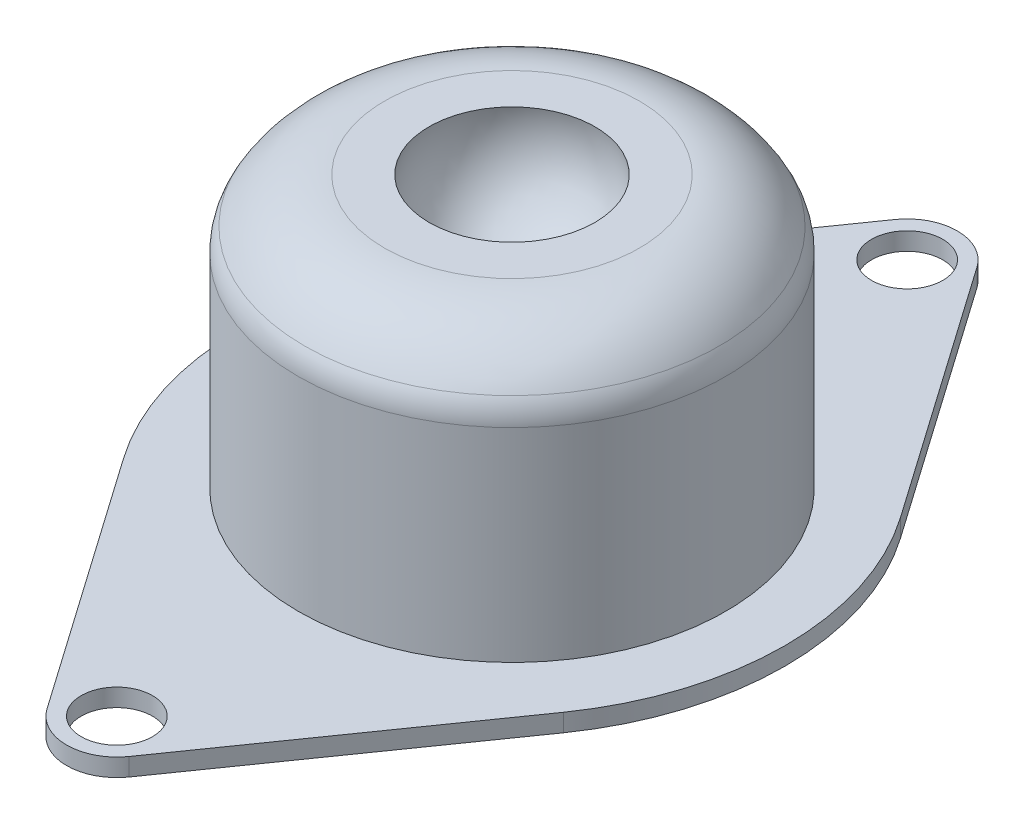
from build123d import *

# Parameters (mm, degrees)
BOSS_EXTRUDE1_DEPTH = 1
FILLET2_R           = 2.5
SKETCH4_R           = 2
CUT_EXTRUDE1_DEPTH  = 34.047536431


with BuildPart() as part:
    # Sketch1 → Boss-Extrude1 (new body)
    with BuildSketch(Plane(origin=(0, 0, 0), x_dir=(1, 0, 0), z_dir=(0, 1, 0))):
        with BuildLine():
            Line((-2.306769174, 23.799171975), (-12.34435681, 9.4640112))
            ThreePointArc((-12.34435681, 9.4640112), (-15.328348079, 0), (-12.34435681, -9.4640112))
            Line((-12.34435681, -9.4640112), (-2.306769174, -23.799171975))
            ThreePointArc((-2.306769174, -23.799171975), (0, -25), (2.306769174, -23.799171975))
            Line((2.306769174, -23.799171975), (12.34435681, -9.4640112))
            ThreePointArc((12.34435681, -9.4640112), (15.328348079, 0), (12.34435681, 9.4640112))
            Line((12.34435681, 9.4640112), (2.306769174, 23.799171975))
            ThreePointArc((2.306769174, 23.799171975), (0, 25), (-2.306769174, 23.799171975))
        make_face()
    extrude(amount=BOSS_EXTRUDE1_DEPTH)

    # Sketch3 → Revolve1 (revolve)
    with BuildSketch(Plane.XY, mode=Mode.PRIVATE) as revolve1_sk:
        with BuildLine():
            Line((0, 1), (12, 1))
            Line((12, 1), (12, 13))
            ThreePointArc((12, 13), (10.06934138, 15.353606271), (7.156329697, 16.2375))
            Line((7.156329697, 16.2375), (4.656329697, 16.2375))
            ThreePointArc((4.656329697, 16.2375), (3.704315473, 12.244265441), (0, 10.475))
            Line((0, 10.475), (0, 1))
        make_face()
    revolve(revolve1_sk.sketch.rotate(Axis((0, 10.475, 0), (0, -1, 0)), 90), axis=Axis((0, 10.475, 0), (0, -1, 0)))

    # Fillet2
    fillet2_edges = [part.edges().sort_by_distance(p)[0] for p in [
        (0, 13, -12),
    ]]
    fillet(fillet2_edges, radius=FILLET2_R)

    # Sketch4 → Cut-Extrude1 (cut, through all)
    with BuildSketch(Plane(origin=(0, 1, 0), x_dir=(1, 0, 0), z_dir=(0, 1, 0))):
        with Locations(Location((0, -22.18395481, 0), (0, 0, 270))):
            Circle(SKETCH4_R)
        with Locations(Location((0, 22.18395481, 0), (0, 0, 270))):
            Circle(SKETCH4_R)
    extrude(amount=-CUT_EXTRUDE1_DEPTH, mode=Mode.SUBTRACT)


solid = part.part
